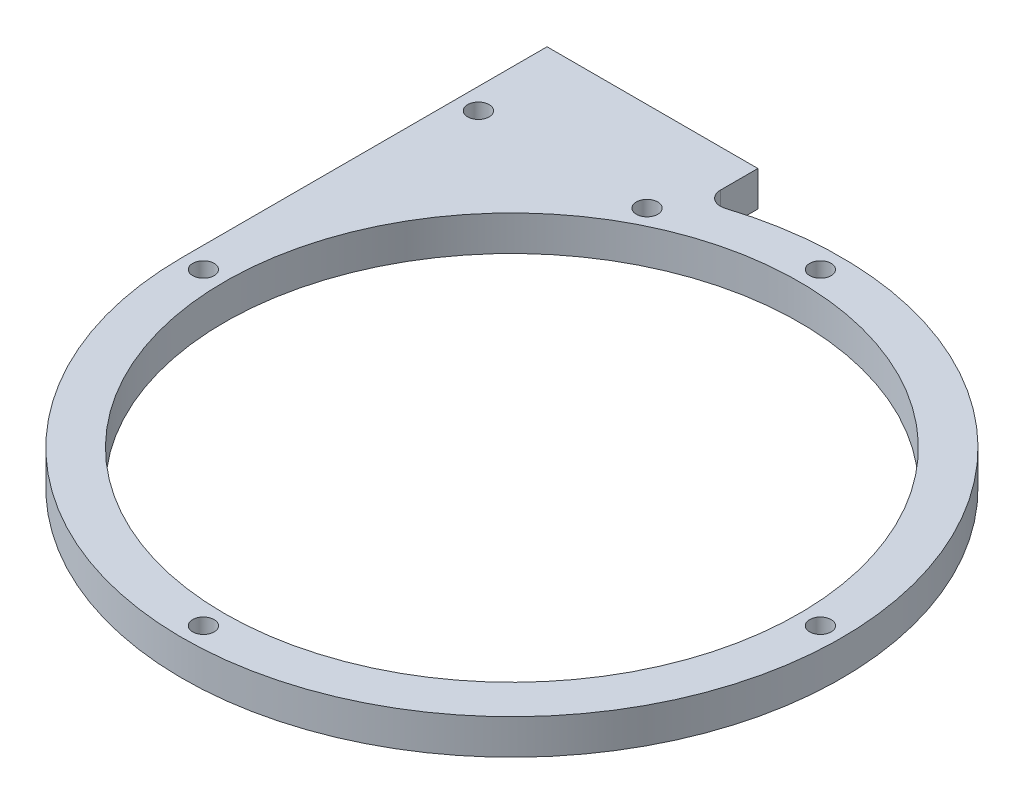
from build123d import *

# Parameters (mm, degrees)
SKETCH_1_R      = 40.9
SKETCH_1_R_2    = 1.525
EXTRUDE_1_DEPTH = 5
SKETCH_3_W      = 30
SKETCH_3_H      = 5
EXTRUDE_2_DEPTH = 5


with BuildPart() as part:
    # 草图1 → 凸台-拉伸1 (new body)
    with BuildSketch(Plane(origin=(0, 0, 0), x_dir=(1, 0, 0), z_dir=(0, 1, 0))):
        with BuildLine():
            Line((-46.9, 0), (-46.9, 46.9))
            Line((-46.9, 46.9), (-16.9, 46.9))
            Line((-16.9, 46.9), (-16.9, 46.574671228))
            ThreePointArc((-16.9, 46.574671228), (-16.079234093, 44.95930534), (-14.290593047, 44.669776699))
            ThreePointArc((-14.290593047, 44.669776699), (37.88033008, -27.65303949), (-46.9, 0))
        make_face()
        with Locations(Location((0, 0, 0), (0, 0, 270))):
            Circle(SKETCH_1_R, mode=Mode.SUBTRACT)
        with Locations(Location((-19.9, 39.130550724, 0), (0, 0, 270))):
            Circle(SKETCH_1_R_2, mode=Mode.SUBTRACT)
        with Locations(Location((0, 43.9, 0), (0, 0, 270))):
            Circle(SKETCH_1_R_2, mode=Mode.SUBTRACT)
        with Locations(Location((43.9, 0, 0), (0, 0, 270))):
            Circle(SKETCH_1_R_2, mode=Mode.SUBTRACT)
        with Locations(Location((0, -43.9, 0), (0, 0, 270))):
            Circle(SKETCH_1_R_2, mode=Mode.SUBTRACT)
        with Locations(Location((-43.9, 0, 0), (0, 0, 270))):
            Circle(SKETCH_1_R_2, mode=Mode.SUBTRACT)
        with Locations(Location((-43.9, 39.130550724, 0), (0, 0, 270))):
            Circle(SKETCH_1_R_2, mode=Mode.SUBTRACT)
    extrude(amount=EXTRUDE_1_DEPTH)

    # 草图3 → 凸台-拉伸2 (add)
    with BuildSketch(Plane(origin=(0, 0, 0), x_dir=(1, 0, 0), z_dir=(0, 1, 0))):
        with Locations((-31.9, 49.4)):
            Rectangle(SKETCH_3_W, SKETCH_3_H)
    extrude(amount=EXTRUDE_2_DEPTH)


solid = part.part
